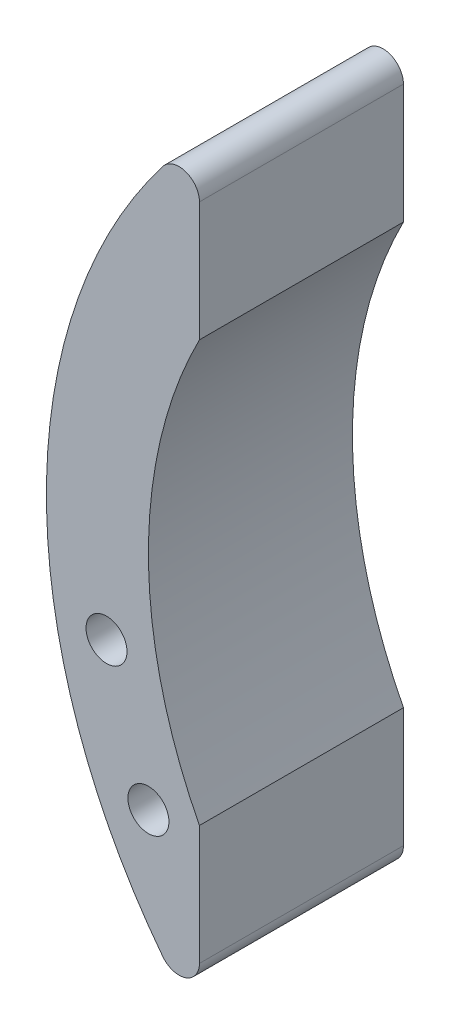
from build123d import *

# Parameters (mm, degrees)
BOSS_EXTRUDE1_DEPTH         = 12.7
BOSS_EXTRUDE1_DEPTH_BACK    = 12.7
SKETCH3_R                   = 69.85
SKETCH3_R_2                 = 57.15
CUT_EXTRUDE1_DEPTH          = 102.996102867
TAP_DRILL_FOR_1_4_20_TAP1_D = 5.1054
FILLET1_R                   = 2.54


with BuildPart() as part:
    # Sketch3 → Boss-Extrude1 (new, two sides: drawn at the far end of the back side and taken through both)
    with BuildSketch(Plane.XY.offset(-BOSS_EXTRUDE1_DEPTH_BACK)):
        Circle(SKETCH3_R)
        Circle(SKETCH3_R_2, mode=Mode.SUBTRACT)
    extrude(amount=BOSS_EXTRUDE1_DEPTH + BOSS_EXTRUDE1_DEPTH_BACK)

    # Sketch4 → Cut-Extrude1 (cut, through all)
    with BuildSketch(Plane.XY.offset(12.7)):
        with BuildLine():
            Line((-50.8, 69.120332123), (-50.8, -69.120332123))
            ThreePointArc((-50.8, -69.120332123), (85.780302592, 0), (-50.8, 69.120332123))
        make_face()
    extrude(amount=-CUT_EXTRUDE1_DEPTH, mode=Mode.SUBTRACT)

    # Tap Drill for 1/4-20 Tap1 (through all)
    with Locations(Plane.XY.offset(12.7)):
        with Locations((-57.15, -27.679008291), (-62.366515468, -11.944360527)):
            Hole(TAP_DRILL_FOR_1_4_20_TAP1_D / 2)

    # Fillet1
    fillet1_edges = [part.edges().sort_by_distance(p)[0] for p in [
        (-50.8, 47.941448664, 0),
        (-50.8, -47.941448664, 0),
    ]]
    fillet(fillet1_edges, radius=FILLET1_R)


solid = part.part
